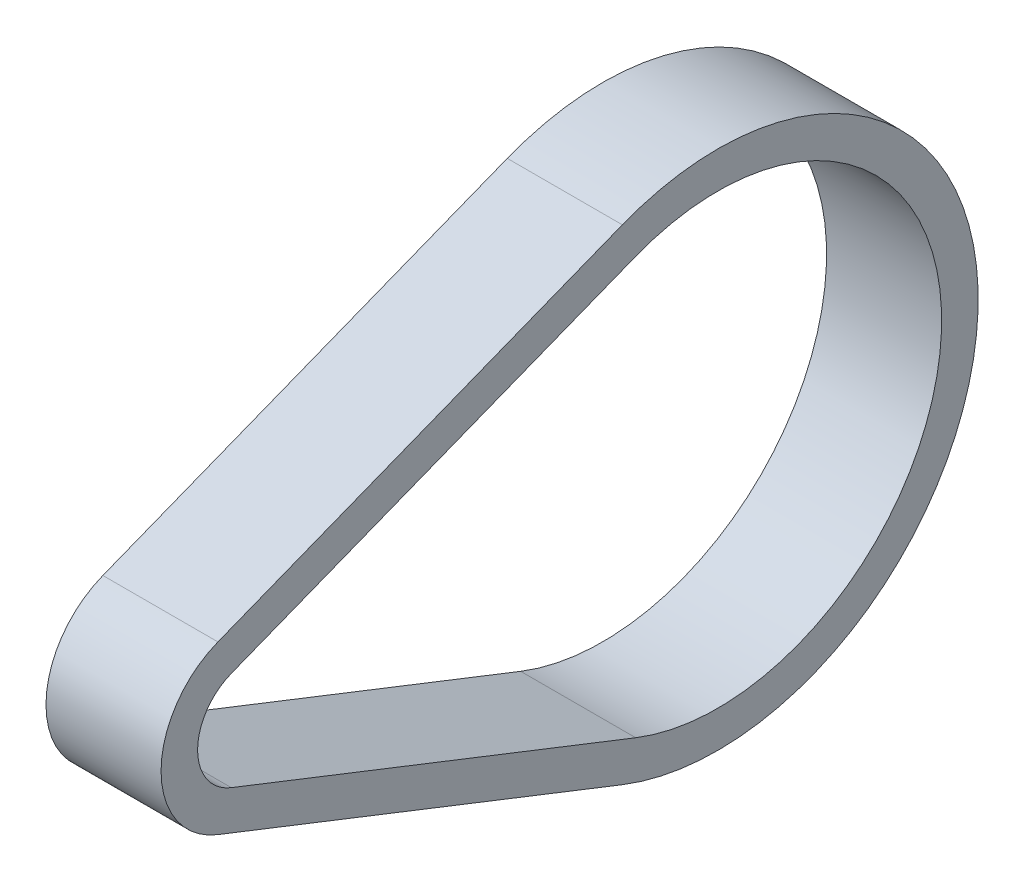
from build123d import *

# Parameters (mm, degrees)
BOSS_EXTRUDE1_DEPTH = 7.5


with BuildPart() as part:
    # Sketch1 → Boss-Extrude1 (new, symmetric)
    with BuildSketch(Plane(origin=(0, 0, 0), x_dir=(0, 0, -1), z_dir=(1, 0, 0))):
        with BuildLine():
            Line((-4.276956627, 10.878521649), (48.447045681, 31.607282261))
            ThreePointArc((48.447045681, 31.607282261), (94.83598, 0), (48.447045681, -31.607282261))
            Line((48.447045681, -31.607282261), (-4.276956627, -10.878521649))
            ThreePointArc((-4.276956627, -10.878521649), (-11.68908, 0), (-4.276956627, 10.878521649))
        make_face()
        with BuildLine():
            Line((-2.534389553, 6.446268695), (50.189612755, 27.175029307))
            ThreePointArc((50.189612755, 27.175029307), (90.07348, 0), (50.189612755, -27.175029307))
            Line((50.189612755, -27.175029307), (-2.534389553, -6.446268695))
            ThreePointArc((-2.534389553, -6.446268695), (-6.92658, 0), (-2.534389553, 6.446268695))
        make_face(mode=Mode.SUBTRACT)
    extrude(amount=BOSS_EXTRUDE1_DEPTH, both=True)


solid = part.part
